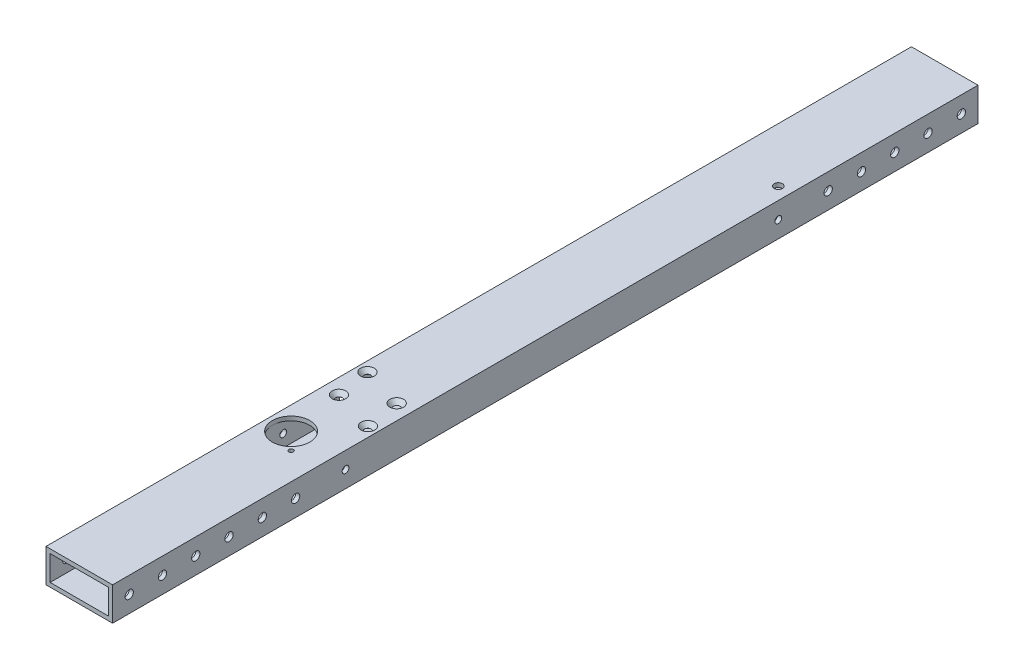
from build123d import *

# Parameters (mm, degrees)
BOSS_EXTRUDE1_DEPTH              = 330.200001
BOSS_EXTRUDE1_DEPTH_BACK         = 330.200001
SKETCH3_W                        = 50.8
SKETCH3_H                        = 25.4
SKETCH3_W_2                      = 44.45
SKETCH3_H_2                      = 19.05
F_1_4_0_25_DIAMETER_HOLE3_D      = 6.35
F_1_4_0_25_DIAMETER_HOLE4_D      = 6.35
F_1_4_0_25_DIAMETER_HOLE5_D      = 6.35
F_1_4_0_25_DIAMETER_HOLE6_D      = 6.35
F_1_4_0_25_DIAMETER_HOLE7_D      = 6.35
F_1_4_0_25_DIAMETER_HOLE8_D      = 6.35
F_13_64_0_20313_DIAMETER_HOLE1_D = 5.159502
F_1_2_0_5_DIAMETER_HOLE1_D       = 12.7
F_1_2_0_5_DIAMETER_HOLE1_DEPTH   = 6.35
F_1_2_0_5_DIAMETER_HOLE1_TIP     = 3.815464931
F_10_CLEARANCE_HOLE4_AT_2_COUNT  = 2
F_10_CLEARANCE_HOLE4_AT_2_PITCH  = 26.422860684
F_10_CLEARANCE_HOLE4_AT_3_COUNT  = 2
F_10_CLEARANCE_HOLE4_AT_3_PITCH  = 32.162957462
F_10_CLEARANCE_HOLE4_AT_4_COUNT  = 2
F_10_CLEARANCE_HOLE4_AT_4_PITCH  = 33.11362798
SKETCH47_R                       = 14.2875
CUT_EXTRUDE1_DEPTH               = 333.148100492
TAP_DRILL_FOR_8_32_TAP1_D        = 3.4544
F_1_4_0_25_DIAMETER_HOLE9_D      = 6.35


with BuildPart() as part:
    # Sketch3 → Boss-Extrude1 (new, two sides: drawn at the far end of the back side and taken through both)
    with BuildSketch(Plane.XY.offset(-BOSS_EXTRUDE1_DEPTH_BACK)):
        Rectangle(SKETCH3_W, SKETCH3_H)
        Rectangle(SKETCH3_W_2, SKETCH3_H_2, mode=Mode.SUBTRACT)
    extrude(amount=BOSS_EXTRUDE1_DEPTH + BOSS_EXTRUDE1_DEPTH_BACK)

    # 1/4 (0.25) Diameter Hole3 (through all)
    with Locations(Plane.ZY.offset(25.4)):
        with Locations((-317.500000508, 0)):
            Hole(F_1_4_0_25_DIAMETER_HOLE3_D / 2)

    # 1/4 (0.25) Diameter Hole4 (through all)
    with Locations(Plane.ZY.offset(25.4)):
        with Locations((292.100000508, 0), (317.500000508, 0)):
            Hole(F_1_4_0_25_DIAMETER_HOLE4_D / 2)

    # 1/4 (0.25) Diameter Hole5 (through all)
    with Locations(Plane(origin=(25.4, 0, 0), x_dir=(0, 0, -1), z_dir=(1, 0, 0))):
        with Locations((292.100000508, 0), (266.700000508, 0)):
            Hole(F_1_4_0_25_DIAMETER_HOLE5_D / 2)

    # 1/4 (0.25) Diameter Hole6 (through all)
    with Locations(Plane(origin=(25.4, 0, 0), x_dir=(0, 0, -1), z_dir=(1, 0, 0))):
        with Locations((215.900000508, 0), (241.300000508, 0)):
            Hole(F_1_4_0_25_DIAMETER_HOLE6_D / 2)

    # 1/4 (0.25) Diameter Hole7 (through all)
    with Locations(Plane(origin=(25.4, 0, 0), x_dir=(0, 0, -1), z_dir=(1, 0, 0))):
        with Locations((-190.5, 0), (-215.9, 0)):
            Hole(F_1_4_0_25_DIAMETER_HOLE7_D / 2)

    # 1/4 (0.25) Diameter Hole8 (through all)
    with Locations(Plane(origin=(25.4, 0, 0), x_dir=(0, 0, -1), z_dir=(1, 0, 0))):
        with Locations((-266.7, 0), (-241.3, 0)):
            Hole(F_1_4_0_25_DIAMETER_HOLE8_D / 2)

    # 13/64 (0.20313) Diameter Hole1 (through all)
    with Locations(Plane(origin=(25.4, 0, 0), x_dir=(0, 0, -1), z_dir=(1, 0, 0))):
        with Locations((-152.4, 0), (177.8, 0)):
            Hole(F_13_64_0_20313_DIAMETER_HOLE1_D / 2)

    # 1/2 (0.5) Diameter Hole1
    with Locations(Plane.ZY.offset(25.4)):
        with Locations((-128.5875, 1.016e-06), (-103.1875, 1.016e-06), (77.7875, 1.016e-06), (103.1875, 1.016e-06)):
            Hole(F_1_2_0_5_DIAMETER_HOLE1_D / 2, depth=F_1_2_0_5_DIAMETER_HOLE1_DEPTH)
            with Locations((0, 0, -(F_1_2_0_5_DIAMETER_HOLE1_DEPTH + F_1_2_0_5_DIAMETER_HOLE1_TIP / 2))):  # 118° drill point
                Cone(0, F_1_2_0_5_DIAMETER_HOLE1_D / 2, F_1_2_0_5_DIAMETER_HOLE1_TIP, mode=Mode.SUBTRACT)

    # Sketch46 → #10 Clearance Hole4 (revolve, cut)
    with BuildSketch(Plane(origin=(13.81901292, -12.7, 101.782101571), x_dir=(0, 0, -1), z_dir=(1, 0, 0))):
        Polygon((0, 0), (0, 25.4), (5.2197, 25.4), (2.4892, 22.258919064), (2.4892, 0), align=None)
    f_10_clearance_hole4 = revolve(axis=Axis((13.81901292, -19.05, 101.782101571), (0, 1, 0)), mode=Mode.SUBTRACT)

    # #10 Clearance Hole4 at 2: #10 Clearance Hole4 ×2
    with Locations(*[Vector(0.15562183859411732, 0, 0.9878167053419306) * (i * F_10_CLEARANCE_HOLE4_AT_2_PITCH) for i in range(1, F_10_CLEARANCE_HOLE4_AT_2_COUNT)]):
        add(f_10_clearance_hole4, mode=Mode.SUBTRACT)

    # #10 Clearance Hole4 at 3: #10 Clearance Hole4 ×2
    with Locations(*[Vector(-0.8593123276123449, 0, 0.511451193774591) * (i * F_10_CLEARANCE_HOLE4_AT_3_PITCH) for i in range(1, F_10_CLEARANCE_HOLE4_AT_3_COUNT)]):
        add(f_10_clearance_hole4, mode=Mode.SUBTRACT)

    # #10 Clearance Hole4 at 4: #10 Clearance Hole4 ×2
    with Locations(*[Vector(-0.9588197348681927, 0, -0.284015344703924) * (i * F_10_CLEARANCE_HOLE4_AT_4_PITCH) for i in range(1, F_10_CLEARANCE_HOLE4_AT_4_COUNT)]):
        add(f_10_clearance_hole4, mode=Mode.SUBTRACT)

    # Sketch47 → Cut-Extrude1 (cut, through all)
    with BuildSketch(Plane.XZ.offset(12.7)):
        with Locations((-7.9375, 160.637603217)):
            Circle(SKETCH47_R)
    extrude(amount=-CUT_EXTRUDE1_DEPTH, mode=Mode.SUBTRACT)

    # Tap Drill for #8-32 Tap1 (through all)
    with Locations(Plane(origin=(0, -12.7, 0), x_dir=(-1, 0, 0), z_dir=(0, -1, 0))):
        with Locations((-4.814463692, -173.389566909)):
            Hole(TAP_DRILL_FOR_8_32_TAP1_D / 2)

    # 1/4 (0.25) Diameter Hole9 (through all)
    with Locations(Plane(origin=(0, -12.7, 0), x_dir=(-1, 0, 0), z_dir=(0, -1, 0))):
        with Locations((-15.875, 187.325)):
            Hole(F_1_4_0_25_DIAMETER_HOLE9_D / 2)


solid = part.part
